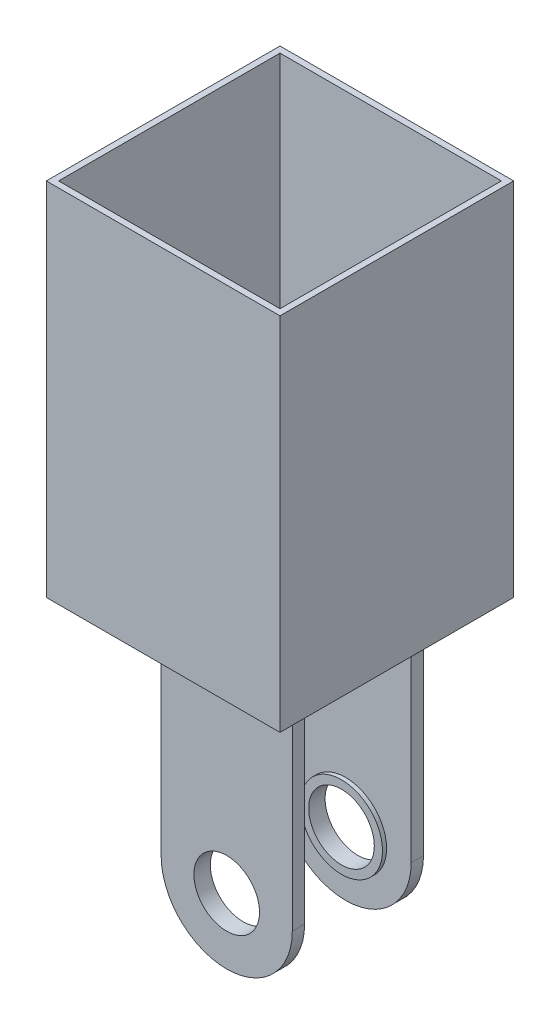
from build123d import *
from build123d.topology import SkipClean

# Parameters (mm, degrees)
SKETCH_1_R          = 8
EXTRUDE_1_DEPTH     = 3
SKETCH_2_R          = 10
SKETCH_2_R_2        = 8
EXTRUDE_3_DEPTH     = 1
SKETCH_4_R          = 8
EXTRUDE_4_DEPTH     = 3
EXTRUDE_START       = 1
SKETCH_5_R          = 10
SKETCH_5_R_2        = 8
EXTRUDE_5_DEPTH     = 1
SKETCH_6_W          = 57
SKETCH_6_H          = 57
EXTRUDE_6_DEPTH     = 3
CUT_EXTRUDE_1_DEPTH = 5
SKETCH_10_R         = 8.25
SKETCH_10_R_2       = 7.25
EXTRUDE_7_DEPTH     = 2
SKETCH_11_W         = 32
SKETCH_11_H         = 37
CUT_EXTRUDE_2_DEPTH = 57
SKETCH_12_W         = 57
SKETCH_12_H         = 57
SKETCH_12_W_2       = 54
SKETCH_12_H_2       = 54
EXTRUDE_8_DEPTH     = 85


with BuildPart() as part:
    # 草图1 → 凸台-拉伸1 (new body)
    with BuildSketch(Plane.XY):
        with BuildLine():
            Line((-16, 0), (-16, 56))
            Line((-16, 56), (-28.5, 56))
            Line((-28.5, 56), (-28.5, 96))
            Line((-28.5, 96), (28.5, 96))
            Line((28.5, 96), (28.5, 56))
            Line((28.5, 56), (16, 56))
            Line((16, 56), (16, 0))
            ThreePointArc((16, 0), (0, -16), (-16, 0))
        make_face()
        Circle(SKETCH_1_R, mode=Mode.SUBTRACT)
    extrude(amount=EXTRUDE_1_DEPTH)

    # 草图2 → 凸台-拉伸3 (add)
    with BuildSketch(Plane.XY.offset(3)):
        Circle(SKETCH_2_R)
        Circle(SKETCH_2_R_2, mode=Mode.SUBTRACT)
    extrude(amount=EXTRUDE_3_DEPTH)



with BuildPart() as body_2:
    # 草图4 → 凸台-拉伸4 (new body)
    with BuildSketch(Plane.XY.offset(29)):
        with BuildLine():
            Line((-16, 0), (-16, 56))
            Line((-16, 56), (-28.5, 56))
            Line((-28.5, 56), (-28.5, 96))
            Line((-28.5, 96), (28.5, 96))
            Line((28.5, 96), (28.5, 56))
            Line((28.5, 56), (16, 56))
            Line((16, 56), (16, 0))
            ThreePointArc((16, 0), (0, -16), (-16, 0))
        make_face()
        Circle(SKETCH_4_R, mode=Mode.SUBTRACT)
    extrude(amount=EXTRUDE_4_DEPTH)

    # 草图5 → 凸台-拉伸5 (add)
    with BuildSketch(Plane(origin=(0, 0, 29), x_dir=(-1, 0, 0), z_dir=(0, 0, -1)).offset(EXTRUDE_START)):
        with Locations(Location((0, 0, 0), (0, 0, 180))):
            Circle(SKETCH_5_R)
        with Locations(Location((0, 0, 0), (0, 0, 180))):
            Circle(SKETCH_5_R_2, mode=Mode.SUBTRACT)
    extrude(amount=-EXTRUDE_5_DEPTH)


with BuildPart() as part_1:
    add(part.part)

    add(body_2.part)  # 凸台-拉伸6 merges body 2
    # 草图6 → 凸台-拉伸6 (add)
    with BuildSketch(Plane.XZ.offset(-56)):
        with Locations((0, 19)):
            Rectangle(SKETCH_6_W, SKETCH_6_H)
    extrude(amount=-EXTRUDE_6_DEPTH)

    # 草图9 → 切除-拉伸1 (cut)
    with BuildSketch(Plane.XZ.offset(-56)):
        with BuildLine():
            ThreePointArc((5.126524164, 24.126524164), (0, 26.25), (-5.126524164, 24.126524164))
            Line((-5.126524164, 24.126524164), (0, 19))
            Line((0, 19), (5.126524164, 24.126524164))
        make_face()
        with BuildLine():
            Line((0, 19), (-5.126524164, 24.126524164))
            ThreePointArc((-5.126524164, 24.126524164), (-7.25, 19), (-5.126524164, 13.873475836))
            Line((-5.126524164, 13.873475836), (0, 19))
        make_face()
        with BuildLine():
            Line((5.126524164, 24.126524164), (0, 19))
            Line((0, 19), (5.126524164, 13.873475836))
            ThreePointArc((5.126524164, 13.873475836), (6.698126611, 16.225545115), (7.25, 19))
            ThreePointArc((7.25, 19), (6.698126611, 21.774454885), (5.126524164, 24.126524164))
        make_face()
        with BuildLine():
            Line((5.126524164, 13.873475836), (0, 19))
            Line((0, 19), (-5.126524164, 13.873475836))
            ThreePointArc((-5.126524164, 13.873475836), (0, 11.75), (5.126524164, 13.873475836))
        make_face()
    extrude(amount=-CUT_EXTRUDE_1_DEPTH, mode=Mode.SUBTRACT)

    # 草图10 → 凸台-拉伸7 (add)
    with SkipClean():  # the faces are left unmerged after this step: merging them gives an invalid solid
        with BuildSketch(Plane(origin=(0, 59, 0), x_dir=(1, 0, 0), z_dir=(0, 1, 0))):
            with Locations((0, -19)):
                Circle(SKETCH_10_R)
            with Locations((0, -19)):
                Circle(SKETCH_10_R_2, mode=Mode.SUBTRACT)
        extrude(amount=EXTRUDE_7_DEPTH)

    # 草图11 → 切除-拉伸2 (cut)
    with BuildSketch(Plane.ZY.offset(28.5)):
        with Locations((16, 77.5)):
            Rectangle(SKETCH_11_W, SKETCH_11_H)
    extrude(amount=-CUT_EXTRUDE_2_DEPTH, mode=Mode.SUBTRACT)

    # 草图12 → 凸台-拉伸8 (add)
    with BuildSketch(Plane(origin=(0, 59, 0), x_dir=(1, 0, 0), z_dir=(0, 1, 0))):
        with Locations((0, -19)):
            Rectangle(SKETCH_12_W, SKETCH_12_H)
        with Locations((0, -19)):
            Rectangle(SKETCH_12_W_2, SKETCH_12_H_2, mode=Mode.SUBTRACT)
    extrude(amount=EXTRUDE_8_DEPTH)


solid = part_1.part
